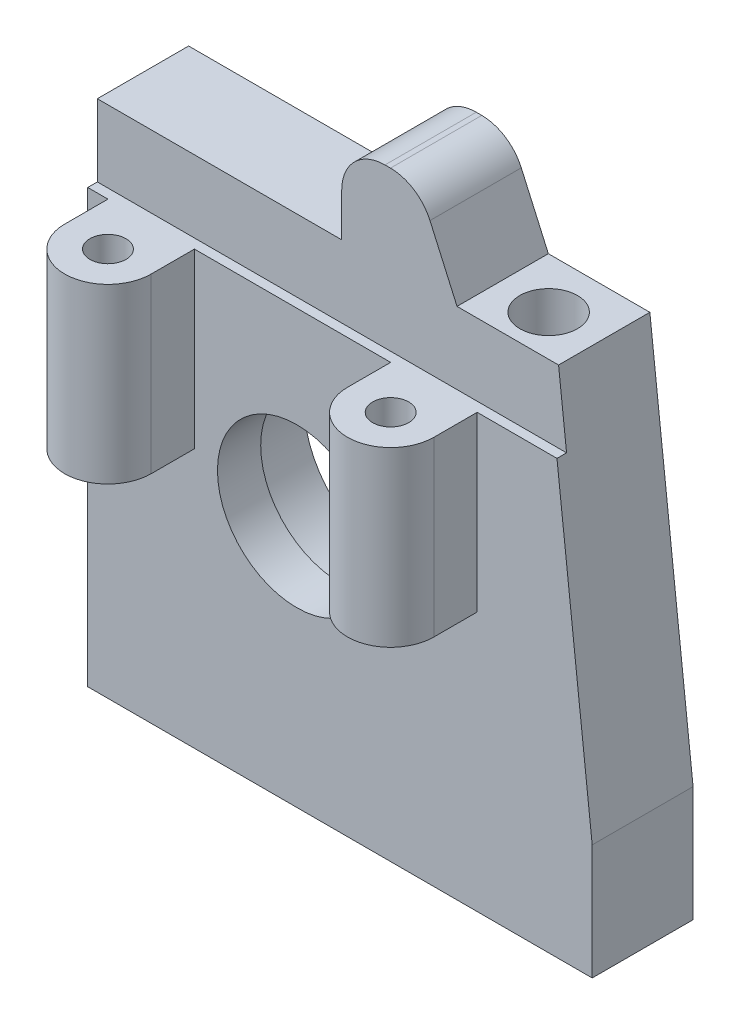
from build123d import *

# Parameters (mm, degrees)
SKETCH1_R           = 5.5
BOSS_EXTRUDE1_DEPTH = 7
SKETCH2_R           = 1.25
CUT_EXTRUDE1_DEPTH  = 12
SKETCH3_R           = 1.25
CUT_EXTRUDE2_DEPTH  = 12
BOSS_EXTRUDE3_DEPTH = 7
FILLET1_R           = 3
SKETCH5_R           = 1
CUT_EXTRUDE3_DEPTH  = 7
SKETCH6_R           = 3
SKETCH6_W           = 6
SKETCH6_H           = 6
BOSS_EXTRUDE5_DEPTH = 12
SKETCH8_R           = 1.25
CUT_EXTRUDE4_DEPTH  = 10
SKETCH9_R           = 2
CUT_EXTRUDE5_DEPTH  = 24
SKETCH10_W          = 5
SKETCH10_H          = 6
CUT_EXTRUDE6_DEPTH  = 4
SKETCH12_R          = 6.5
CUT_EXTRUDE9_DEPTH  = 4
SKETCH13_W          = 35
SKETCH13_H          = 0.258068079
CUT_EXTRUDE10_DEPTH = 11
SKETCH14_W          = 33.43687833
SKETCH14_H          = 0.407122994
CUT_EXTRUDE11_DEPTH = 11
SKETCH15_R          = 1
BOSS_EXTRUDE6_DEPTH = 2
SKETCH16_R          = 1.25
CUT_EXTRUDE12_DEPTH = 5


with BuildPart() as part:
    # Sketch1 → Boss-Extrude1 (new body)
    with BuildSketch(Plane.XY):
        Polygon((0, 0), (0, 35), (32, 35), (35, 8), (35, 0), align=None)
        with Locations((14.5, 17.5)):
            Circle(SKETCH1_R, mode=Mode.SUBTRACT)
    extrude(amount=BOSS_EXTRUDE1_DEPTH)

    # Sketch2 → Cut-Extrude1 (cut)
    with BuildSketch(Plane.XZ):
        with Locations((6, 3.5)):
            Circle(SKETCH2_R)
    extrude(amount=-CUT_EXTRUDE1_DEPTH, mode=Mode.SUBTRACT)

    # Sketch3 → Cut-Extrude2 (cut)
    with BuildSketch(Plane.XZ):
        with Locations((24, 3.5)):
            Circle(SKETCH3_R)
    extrude(amount=-CUT_EXTRUDE2_DEPTH, mode=Mode.SUBTRACT)

    # Sketch4 → Boss-Extrude3 (add)
    with BuildSketch(Plane.XY.offset(7)):
        Polygon((16.95692267, 41), (16.95692267, 35), (24.95692267, 35), (22.287605299, 41), align=None)
    extrude(amount=-BOSS_EXTRUDE3_DEPTH)

    # Fillet1
    fillet1_edges = [part.edges().sort_by_distance(p)[0] for p in [
        (22.287605299, 41, 3.5),
        (16.95692267, 41, 3.5),
    ]]
    fillet(fillet1_edges, radius=FILLET1_R)

    # Sketch5 → Cut-Extrude3 (cut)
    with BuildSketch(Plane.XY.offset(7)):
        with Locations((19.95692267, 38)):
            Circle(SKETCH5_R)
    extrude(amount=-CUT_EXTRUDE3_DEPTH, mode=Mode.SUBTRACT)

    # Sketch6 → Boss-Extrude5 (add)
    with BuildSketch(Plane(origin=(0, 18, 0), x_dir=(1, 0, 0), z_dir=(0, 1, 0))):
        with Locations((4.401568824, -10)):
            Circle(SKETCH6_R)
        with Locations((24.018340299, -10)):
            Circle(SKETCH6_R)
        with Locations((4.401568824, -7)):
            Rectangle(SKETCH6_W, SKETCH6_H)
        with Locations((24.018340299, -7)):
            Rectangle(SKETCH6_W, SKETCH6_H)
    extrude(amount=BOSS_EXTRUDE5_DEPTH)

    # Sketch8 → Cut-Extrude4 (cut)
    with BuildSketch(Plane(origin=(0, 30, 0), x_dir=(1, 0, 0), z_dir=(0, 1, 0))):
        with Locations(Location((4.401568824, -10, 0), (0, 0, 180))):
            Circle(SKETCH8_R)
        with Locations(Location((24.018340299, -10, 0), (0, 0, 180))):
            Circle(SKETCH8_R)
    extrude(amount=-CUT_EXTRUDE4_DEPTH, mode=Mode.SUBTRACT)

    # Sketch9 → Cut-Extrude5 (cut)
    with BuildSketch(Plane(origin=(0, 35, 0), x_dir=(1, 0, 0), z_dir=(0, 1, 0))):
        with Locations(Location((28.478461335, -3.5, 0), (0, 0, 180))):
            Circle(SKETCH9_R)
    extrude(amount=-CUT_EXTRUDE5_DEPTH, mode=Mode.SUBTRACT)

    # Sketch10 → Cut-Extrude6 (cut)
    with BuildSketch(Plane(origin=(0, 0, 0), x_dir=(-1, 0, 0), z_dir=(0, 0, -1))):
        with Locations((-28.609401926, 18)):
            Rectangle(SKETCH10_W, SKETCH10_H)
    extrude(amount=-CUT_EXTRUDE6_DEPTH, mode=Mode.SUBTRACT)

    # Sketch12 → Cut-Extrude9 (cut)
    with BuildSketch(Plane(origin=(0, 0, 0), x_dir=(-1, 0, 0), z_dir=(0, 0, -1))):
        with Locations((-14.5, 17.5)):
            Circle(SKETCH12_R)
    extrude(amount=-CUT_EXTRUDE9_DEPTH, mode=Mode.SUBTRACT)

    # Sketch13 → Cut-Extrude10 (cut)
    with BuildSketch(Plane(origin=(0, 41, 0), x_dir=(1, 0, 0), z_dir=(0, 1, 0))):
        with Locations((17.5, -6.870965961)):
            Rectangle(SKETCH13_W, SKETCH13_H)
    extrude(amount=-CUT_EXTRUDE10_DEPTH, mode=Mode.SUBTRACT)

    # Sketch14 → Cut-Extrude11 (cut)
    with BuildSketch(Plane(origin=(0, 41, 0), x_dir=(1, 0, 0), z_dir=(0, 1, 0))):
        with Locations((16.718439165, -6.538370424)):
            Rectangle(SKETCH14_W, SKETCH14_H)
    extrude(amount=-CUT_EXTRUDE11_DEPTH, mode=Mode.SUBTRACT)

    # Sketch15 → Boss-Extrude6 (add)
    with BuildSketch(Plane.XY.offset(6.334808927)):
        with Locations((19.95692267, 38)):
            Circle(SKETCH15_R)
    extrude(amount=-BOSS_EXTRUDE6_DEPTH)

    # Sketch16 → Cut-Extrude12 (cut)
    with BuildSketch(Plane(origin=(0, 0, 0), x_dir=(-1, 0, 0), z_dir=(0, 0, -1))):
        with Locations((-29.943004203, 5.499566532)):
            Circle(SKETCH16_R)
    extrude(amount=-CUT_EXTRUDE12_DEPTH, mode=Mode.SUBTRACT)


solid = part.part
